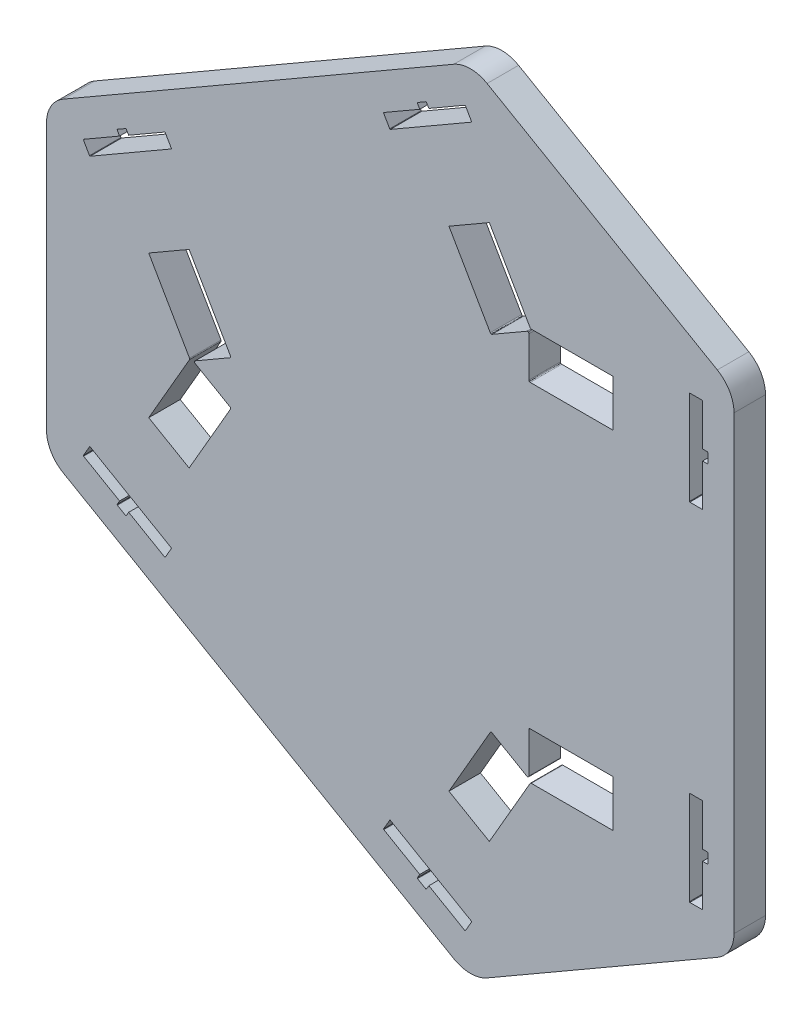
from build123d import *

# Parameters (mm, degrees)
SALIENTE_EXTRUIR1_DEPTH = 6


with BuildPart() as part:
    # Model → Saliente-Extruir1 (new body)
    with BuildSketch(Plane.XY):
        with BuildLine():
            Line((113.357081542, 26.21056425), (157.224997542, 51.53767625))
            add(Edge.make_bspline(
                [(157.224997542, 51.53767625), (159.190322542, 52.67288025), (160.400350542, 54.76749825), (160.399997542, 57.03698825)],
                knots=[0, 0, 0, 0, 1, 1, 1, 1], degree=3))
            Line((160.399997542, 57.03698825), (160.399997542, 142.96314225))
            add(Edge.make_bspline(
                [(160.399997542, 142.96314225), (160.399645542, 145.23256125), (159.190675542, 147.32841425), (157.224997542, 148.46259425)],
                knots=[0, 0, 0, 0, 1, 1, 1, 1], degree=3))
            Line((157.224997542, 148.46259425), (113.357081542, 173.78956925))
            add(Edge.make_bspline(
                [(113.357081542, 173.78956925), (111.391403542, 174.92375025), (108.972053542, 174.92480825), (107.007081542, 173.78956925)],
                knots=[0, 0, 0, 0, 1, 1, 1, 1], degree=3))
            Line((107.007081542, 173.78956925), (32.592792542, 130.82652825))
            add(Edge.make_bspline(
                [(32.592792542, 130.82652825), (30.627711542, 129.69128925), (29.417379542, 127.59649425), (29.417792542, 125.32707525)],
                knots=[0, 0, 0, 0, 1, 1, 1, 1], degree=3))
            Line((29.417792542, 125.32707525), (29.417792542, 74.67277225))
            add(Edge.make_bspline(
                [(29.417792542, 74.67277225), (29.418206542, 72.40335325), (30.627157542, 70.30785325), (32.592792542, 69.17367225)],
                knots=[0, 0, 0, 0, 1, 1, 1, 1], degree=3))
            Line((32.592792542, 69.17367225), (107.007081542, 26.21056425))
            add(Edge.make_bspline(
                [(107.007081542, 26.21056425), (108.972758542, 25.07630125), (111.391756542, 25.07533725), (113.357081542, 26.21056425)],
                knots=[0, 0, 0, 0, 1, 1, 1, 1], degree=3))
        make_face()
        with BuildLine():
            Line((52.048078542, 135.01541125), (53.198063542, 133.02362825))
            add(Edge.make_bspline(
                [(53.198063542, 133.02362825), (53.211292542, 133.00069725), (53.214855542, 132.97318125), (53.207976542, 132.94778125)],
                knots=[0, 0, 0, 0, 1, 1, 1, 1], degree=3))
            add(Edge.make_bspline(
                [(53.207976542, 132.94778125), (53.201202542, 132.92202825), (53.184269542, 132.90015625), (53.161374542, 132.88710325)],
                knots=[0, 0, 0, 0, 1, 1, 1, 1], degree=3))
            Line((53.161374542, 132.88710325), (37.746114542, 123.98687225))
            add(Edge.make_bspline(
                [(37.746114542, 123.98687225), (37.723218542, 123.97346725), (37.695949542, 123.96993925), (37.670302542, 123.97699425)],
                knots=[0, 0, 0, 0, 1, 1, 1, 1], degree=3))
            add(Edge.make_bspline(
                [(37.670302542, 123.97699425), (37.644690542, 123.98369725), (37.622783542, 124.00063125), (37.609553542, 124.02356125)],
                knots=[0, 0, 0, 0, 1, 1, 1, 1], degree=3))
            Line((37.609553542, 124.02356125), (36.459568542, 126.01534425))
            add(Edge.make_bspline(
                [(36.459568542, 126.01534425), (36.446339542, 126.03827525), (36.442741542, 126.06543925), (36.449514542, 126.09119225)],
                knots=[0, 0, 0, 0, 1, 1, 1, 1], degree=3))
            add(Edge.make_bspline(
                [(36.449514542, 126.09119225), (36.456393542, 126.11694425), (36.473221542, 126.13881725), (36.496081542, 126.15186925)],
                knots=[0, 0, 0, 0, 1, 1, 1, 1], degree=3))
            Line((36.496081542, 126.15186925), (43.337783542, 130.10192225))
            Line((43.337783542, 130.10192225), (42.887709542, 130.88156125))
            add(Edge.make_bspline(
                [(42.887709542, 130.88156125), (42.874480542, 130.90413925), (42.870881542, 130.93165625), (42.877796542, 130.95705625)],
                knots=[0, 0, 0, 0, 1, 1, 1, 1], degree=3))
            add(Edge.make_bspline(
                [(42.877796542, 130.95705625), (42.884675542, 130.98280825), (42.901467542, 131.00468125), (42.924362542, 131.01808625)],
                knots=[0, 0, 0, 0, 1, 1, 1, 1], degree=3))
            Line((42.924362542, 131.01808625), (44.483182542, 131.91802225))
            add(Edge.make_bspline(
                [(44.483182542, 131.91802225), (44.506077542, 131.93107525), (44.533347542, 131.93460325), (44.558993542, 131.92790025)],
                knots=[0, 0, 0, 0, 1, 1, 1, 1], degree=3))
            add(Edge.make_bspline(
                [(44.558993542, 131.92790025), (44.584605542, 131.92119725), (44.606513542, 131.90426425), (44.619742542, 131.88133325)],
                knots=[0, 0, 0, 0, 1, 1, 1, 1], degree=3))
            Line((44.619742542, 131.88133325), (45.069816542, 131.10204725))
            Line((45.069816542, 131.10204725), (51.911376542, 135.05174725))
            add(Edge.make_bspline(
                [(51.911376542, 135.05174725), (51.934377542, 135.06515325), (51.961682542, 135.06868125), (51.987153542, 135.06197825)],
                knots=[0, 0, 0, 0, 1, 1, 1, 1], degree=3))
            add(Edge.make_bspline(
                [(51.987153542, 135.06197825), (52.012800542, 135.05492225), (52.034707542, 135.03834225), (52.048078542, 135.01541125)],
                knots=[0, 0, 0, 0, 1, 1, 1, 1], degree=3))
        make_face(mode=Mode.SUBTRACT)
        with BuildLine():
            Line((36.459568542, 73.98485625), (37.609553542, 75.97663925))
            add(Edge.make_bspline(
                [(37.609553542, 75.97663925), (37.622783542, 75.99992225), (37.644690542, 76.01650325), (37.670161542, 76.02320625)],
                knots=[0, 0, 0, 0, 1, 1, 1, 1], degree=3))
            add(Edge.make_bspline(
                [(37.670161542, 76.02320625), (37.695808542, 76.03026125), (37.723218542, 76.02673325), (37.746114542, 76.01332825)],
                knots=[0, 0, 0, 0, 1, 1, 1, 1], degree=3))
            Line((37.746114542, 76.01332825), (53.161374542, 67.11345025))
            add(Edge.make_bspline(
                [(53.161374542, 67.11345025), (53.184410542, 67.10039725), (53.201061542, 67.07852525), (53.207976542, 67.05277225)],
                knots=[0, 0, 0, 0, 1, 1, 1, 1], degree=3))
            add(Edge.make_bspline(
                [(53.207976542, 67.05277225), (53.214855542, 67.02737225), (53.211292542, 66.99985625), (53.198063542, 66.97692525)],
                knots=[0, 0, 0, 0, 1, 1, 1, 1], degree=3))
            Line((53.198063542, 66.97692525), (52.048078542, 64.98514225))
            add(Edge.make_bspline(
                [(52.048078542, 64.98514225), (52.034848542, 64.96185825), (52.012941542, 64.94527825), (51.987294542, 64.93857525)],
                knots=[0, 0, 0, 0, 1, 1, 1, 1], degree=3))
            add(Edge.make_bspline(
                [(51.987294542, 64.93857525), (51.961823542, 64.93151925), (51.934377542, 64.93504725), (51.911376542, 64.94845325)],
                knots=[0, 0, 0, 0, 1, 1, 1, 1], degree=3))
            Line((51.911376542, 64.94845325), (45.069816542, 68.89850625))
            Line((45.069816542, 68.89850625), (44.619742542, 68.11921925))
            add(Edge.make_bspline(
                [(44.619742542, 68.11921925), (44.606654542, 68.09593625), (44.584746542, 68.07935625), (44.559135542, 68.07230025)],
                knots=[0, 0, 0, 0, 1, 1, 1, 1], degree=3))
            add(Edge.make_bspline(
                [(44.559135542, 68.07230025), (44.533488542, 68.06559725), (44.506218542, 68.06912525), (44.483182542, 68.08253125)],
                knots=[0, 0, 0, 0, 1, 1, 1, 1], degree=3))
            Line((44.483182542, 68.08253125), (42.924362542, 68.98246725))
            add(Edge.make_bspline(
                [(42.924362542, 68.98246725), (42.901467542, 68.99551925), (42.884675542, 69.01739225), (42.877796542, 69.04314425)],
                knots=[0, 0, 0, 0, 1, 1, 1, 1], degree=3))
            add(Edge.make_bspline(
                [(42.877796542, 69.04314425), (42.870881542, 69.06854425), (42.874480542, 69.09606125), (42.887709542, 69.11899225)],
                knots=[0, 0, 0, 0, 1, 1, 1, 1], degree=3))
            Line((42.887709542, 69.11899225), (43.337783542, 69.89827825))
            Line((43.337783542, 69.89827825), (36.496081542, 73.84833125))
            add(Edge.make_bspline(
                [(36.496081542, 73.84833125), (36.473221542, 73.86173625), (36.456393542, 73.88325625), (36.449514542, 73.90900825)],
                knots=[0, 0, 0, 0, 1, 1, 1, 1], degree=3))
            add(Edge.make_bspline(
                [(36.449514542, 73.90900825), (36.442741542, 73.93476125), (36.446339542, 73.96192525), (36.459568542, 73.98485625)],
                knots=[0, 0, 0, 0, 1, 1, 1, 1], degree=3))
        make_face(mode=Mode.SUBTRACT)
        with BuildLine():
            Line((110.390220542, 33.95678425), (109.240517542, 31.96496525))
            add(Edge.make_bspline(
                [(109.240517542, 31.96496525), (109.227111542, 31.94196425), (109.205239542, 31.92527825), (109.179839542, 31.91839925)],
                knots=[0, 0, 0, 0, 1, 1, 1, 1], degree=3))
            add(Edge.make_bspline(
                [(109.179839542, 31.91839925), (109.154086542, 31.91151925), (109.126570542, 31.91508225), (109.103639542, 31.92845325)],
                knots=[0, 0, 0, 0, 1, 1, 1, 1], degree=3))
            Line((109.103639542, 31.92845325), (102.262220542, 35.87847025))
            Line((102.262220542, 35.87847025), (101.812075542, 35.09904325))
            add(Edge.make_bspline(
                [(101.812075542, 35.09904325), (101.799022542, 35.07604225), (101.777150542, 35.05921425), (101.751397542, 35.05247625)],
                knots=[0, 0, 0, 0, 1, 1, 1, 1], degree=3))
            add(Edge.make_bspline(
                [(101.751397542, 35.05247625), (101.725997542, 35.04545625), (101.698481542, 35.04916025), (101.675550542, 35.06238925)],
                knots=[0, 0, 0, 0, 1, 1, 1, 1], degree=3))
            Line((101.675550542, 35.06238925), (100.116625542, 35.96239625))
            add(Edge.make_bspline(
                [(100.116625542, 35.96239625), (100.093695542, 35.97562525), (100.077114542, 35.99739225), (100.070058542, 36.02303925)],
                knots=[0, 0, 0, 0, 1, 1, 1, 1], degree=3))
            add(Edge.make_bspline(
                [(100.070058542, 36.02303925), (100.063356542, 36.04865025), (100.066883542, 36.07595525), (100.080289542, 36.09895625)],
                knots=[0, 0, 0, 0, 1, 1, 1, 1], degree=3))
            Line((100.080289542, 36.09895625), (100.530081542, 36.87838425))
            Line((100.530081542, 36.87838425), (93.688661542, 40.82836625))
            add(Edge.make_bspline(
                [(93.688661542, 40.82836625), (93.665378542, 40.84159525), (93.648797542, 40.86339725), (93.642095542, 40.88900825)],
                knots=[0, 0, 0, 0, 1, 1, 1, 1], degree=3))
            add(Edge.make_bspline(
                [(93.642095542, 40.88900825), (93.635039542, 40.91465525), (93.638567542, 40.94206625), (93.651972542, 40.96496125)],
                knots=[0, 0, 0, 0, 1, 1, 1, 1], degree=3))
            Line((93.651972542, 40.96496125), (94.802028542, 42.95674525))
            add(Edge.make_bspline(
                [(94.802028542, 42.95674525), (94.815081542, 42.97978125), (94.836953542, 42.99657325), (94.862353542, 43.00334725)],
                knots=[0, 0, 0, 0, 1, 1, 1, 1], degree=3))
            add(Edge.make_bspline(
                [(94.862353542, 43.00334725), (94.888106542, 43.01036725), (94.915622542, 43.00666325), (94.938553542, 42.99343425)],
                knots=[0, 0, 0, 0, 1, 1, 1, 1], degree=3))
            Line((94.938553542, 42.99343425), (110.353531542, 34.09334425))
            add(Edge.make_bspline(
                [(110.353531542, 34.09334425), (110.376814542, 34.08025625), (110.393395542, 34.05834925), (110.400450542, 34.03287825)],
                knots=[0, 0, 0, 0, 1, 1, 1, 1], degree=3))
            add(Edge.make_bspline(
                [(110.400450542, 34.03287825), (110.407153542, 34.00723125), (110.403625542, 33.97982025), (110.390220542, 33.95678425)],
                knots=[0, 0, 0, 0, 1, 1, 1, 1], degree=3))
        make_face(mode=Mode.SUBTRACT)
        with BuildLine():
            Line((155.400078542, 133.92038925), (155.400078542, 132.12016425))
            add(Edge.make_bspline(
                [(155.400078542, 132.12016425), (155.400078542, 132.09370625), (155.389495542, 132.06830625), (155.370797542, 132.04960825)],
                knots=[0, 0, 0, 0, 1, 1, 1, 1], degree=3))
            add(Edge.make_bspline(
                [(155.370797542, 132.04960825), (155.352100542, 132.03055825), (155.326347542, 132.02032825), (155.299889542, 132.02032825)],
                knots=[0, 0, 0, 0, 1, 1, 1, 1], degree=3))
            Line((155.299889542, 132.02032825), (154.399953542, 132.02032825))
            Line((154.399953542, 132.02032825), (154.399953542, 124.12022225))
            add(Edge.make_bspline(
                [(154.399953542, 124.12022225), (154.399953542, 124.09376425), (154.389370542, 124.06836425), (154.370672542, 124.04931425)],
                knots=[0, 0, 0, 0, 1, 1, 1, 1], degree=3))
            add(Edge.make_bspline(
                [(154.370672542, 124.04931425), (154.351975542, 124.03061725), (154.326575542, 124.02038625), (154.299764542, 124.02038625)],
                knots=[0, 0, 0, 0, 1, 1, 1, 1], degree=3))
            Line((154.299764542, 124.02038625), (152.000006542, 124.02038625))
            add(Edge.make_bspline(
                [(152.000006542, 124.02038625), (151.973547542, 124.02003325), (151.948147542, 124.03061725), (151.929097542, 124.04931425)],
                knots=[0, 0, 0, 0, 1, 1, 1, 1], degree=3))
            add(Edge.make_bspline(
                [(151.929097542, 124.04931425), (151.910400542, 124.06801125), (151.899817542, 124.09376425), (151.899817542, 124.12022225)],
                knots=[0, 0, 0, 0, 1, 1, 1, 1], degree=3))
            Line((151.899817542, 124.12022225), (151.899817542, 141.92033125))
            add(Edge.make_bspline(
                [(151.899817542, 141.92033125), (151.899817542, 141.94678925), (151.910400542, 141.97218925), (151.929097542, 141.99088625)],
                knots=[0, 0, 0, 0, 1, 1, 1, 1], degree=3))
            add(Edge.make_bspline(
                [(151.929097542, 141.99088625), (151.948147542, 142.00958325), (151.973547542, 142.02016725), (152.000006542, 142.02016725)],
                knots=[0, 0, 0, 0, 1, 1, 1, 1], degree=3))
            Line((152.000006542, 142.02016725), (154.299764542, 142.02016725))
            add(Edge.make_bspline(
                [(154.299764542, 142.02016725), (154.326575542, 142.02016725), (154.351975542, 142.00958325), (154.370672542, 141.99088625)],
                knots=[0, 0, 0, 0, 1, 1, 1, 1], degree=3))
            add(Edge.make_bspline(
                [(154.370672542, 141.99088625), (154.389370542, 141.97218925), (154.399953542, 141.94678925), (154.399953542, 141.92033125)],
                knots=[0, 0, 0, 0, 1, 1, 1, 1], degree=3))
            Line((154.399953542, 141.92033125), (154.399953542, 134.02022525))
            Line((154.399953542, 134.02022525), (155.299889542, 134.02022525))
            add(Edge.make_bspline(
                [(155.299889542, 134.02022525), (155.326347542, 134.02022525), (155.351747542, 134.00964225), (155.370797542, 133.99094425)],
                knots=[0, 0, 0, 0, 1, 1, 1, 1], degree=3))
            add(Edge.make_bspline(
                [(155.370797542, 133.99094425), (155.389495542, 133.97224725), (155.400078542, 133.94684725), (155.400078542, 133.92038925)],
                knots=[0, 0, 0, 0, 1, 1, 1, 1], degree=3))
        make_face(mode=Mode.SUBTRACT)
        with BuildLine():
            Line((121.31992491, 128.831895052), (121.320083692, 136.487462979))
            add(Edge.make_bspline(
                [(121.320083692, 136.487462979), (121.319954506, 136.578255399), (121.271119345, 136.662298528), (121.192460467, 136.707385355)],
                knots=[0, 0, 0, 0, 1, 1, 1, 1], degree=3))
            add(Edge.make_bspline(
                [(121.192460467, 136.707385355), (121.113567748, 136.752771157), (121.017547937, 136.752971857), (120.939106745, 136.707419551)],
                knots=[0, 0, 0, 0, 1, 1, 1, 1], degree=3))
            Line((120.939106745, 136.707419551), (114.308973597, 132.879659169))
            add(Edge.make_bspline(
                [(114.308973597, 132.879659169), (114.25079266, 132.845914699), (114.181536987, 132.836732259), (114.116267685, 132.854210473)],
                knots=[0, 0, 0, 0, 1, 1, 1, 1], degree=3))
            add(Edge.make_bspline(
                [(114.116267685, 132.854210473), (114.051304091, 132.871512188), (113.995739376, 132.914265298), (113.962209337, 132.972607644)],
                knots=[0, 0, 0, 0, 1, 1, 1, 1], degree=3))
            Line((113.962209337, 132.972607644), (106.088920823, 146.609023042))
            Line((106.088920823, 146.609023042), (113.787789899, 151.053794417))
            Line((113.787789899, 151.053794417), (121.55860695, 137.594865806))
            add(Edge.make_bspline(
                [(121.55860695, 137.594865806), (121.604070391, 137.516272694), (121.688087034, 137.467765788), (121.778577546, 137.467866053)],
                knots=[0, 0, 0, 0, 1, 1, 1, 1], degree=3))
            Line((121.778577546, 137.467866053), (137.320104025, 137.467640325))
            Line((137.320104025, 137.467640325), (137.319919654, 128.57832527))
            Line((137.319919654, 128.57832527), (121.574109058, 128.577886702))
            add(Edge.make_bspline(
                [(121.574109058, 128.577886702), (121.506818085, 128.577753243), (121.442010388, 128.604496997), (121.394544759, 128.652106156)],
                knots=[0, 0, 0, 0, 1, 1, 1, 1], degree=3))
            add(Edge.make_bspline(
                [(121.394544759, 128.652106156), (121.346702923, 128.699769705), (121.320168168, 128.764582256), (121.31992491, 128.831895052)],
                knots=[0, 0, 0, 0, 1, 1, 1, 1], degree=3))
        make_face(mode=Mode.SUBTRACT)
        with BuildLine():
            Line((114.308949948, 67.120442979), (120.938783406, 63.292515521))
            add(Edge.make_bspline(
                [(120.938783406, 63.292515521), (121.0174765, 63.247231119), (121.114677566, 63.247501956), (121.193053383, 63.293079058)],
                knots=[0, 0, 0, 0, 1, 1, 1, 1], degree=3))
            add(Edge.make_bspline(
                [(121.193053383, 63.293079058), (121.271805041, 63.338709185), (121.319988834, 63.421764387), (121.319760057, 63.512472605)],
                knots=[0, 0, 0, 0, 1, 1, 1, 1], degree=3))
            Line((121.319760057, 63.512472605), (121.319895812, 71.168216533))
            add(Edge.make_bspline(
                [(121.319895812, 71.168216533), (121.319762772, 71.235474938), (121.346438441, 71.300043306), (121.394209713, 71.347829029)],
                knots=[0, 0, 0, 0, 1, 1, 1, 1], degree=3))
            add(Edge.make_bspline(
                [(121.394209713, 71.347829029), (121.441675277, 71.395438252), (121.506482939, 71.422182093), (121.573773911, 71.422048725)],
                knots=[0, 0, 0, 0, 1, 1, 1, 1], degree=3))
            Line((121.573773911, 71.422048725), (137.31990032, 71.422294676))
            Line((137.31990032, 71.422294676), (137.319742682, 62.532492789))
            Line((137.319742682, 62.532492789), (121.778560071, 62.532246148))
            add(Edge.make_bspline(
                [(121.778560071, 62.532246148), (121.687764719, 62.532170292), (121.603748141, 62.483663273), (121.558589647, 62.405246099)],
                knots=[0, 0, 0, 0, 1, 1, 1, 1], degree=3))
            Line((121.558589647, 62.405246099), (113.787618771, 48.946009234))
            Line((113.787618771, 48.946009234), (106.089342309, 53.390833381))
            Line((106.089342309, 53.390833381), (113.961880106, 67.027317538))
            add(Edge.make_bspline(
                [(113.961880106, 67.027317538), (113.995410065, 67.085659929), (114.050974723, 67.128413114), (114.115938295, 67.145714916)],
                knots=[0, 0, 0, 0, 1, 1, 1, 1], degree=3))
            add(Edge.make_bspline(
                [(114.115938295, 67.145714916), (114.181137073, 67.163315327), (114.250533758, 67.153888762), (114.308949948, 67.120442979)],
                knots=[0, 0, 0, 0, 1, 1, 1, 1], degree=3))
        make_face(mode=Mode.SUBTRACT)
        with BuildLine():
            Line((64.37094141, 104.04778068), (57.74094141, 100.22014168))
            add(Edge.make_bspline(
                [(57.74094141, 100.22014168), (57.66237741, 100.17463368), (57.61401141, 100.09031968), (57.61429441, 99.99965568)],
                knots=[0, 0, 0, 0, 1, 1, 1, 1], degree=3))
            add(Edge.make_bspline(
                [(57.61429441, 99.99965568), (57.61443541, 99.90863968), (57.66227141, 99.82538368), (57.74094141, 99.78022768)],
                knots=[0, 0, 0, 0, 1, 1, 1, 1], degree=3))
            Line((57.74094141, 99.78022768), (64.37094141, 95.95223668))
            add(Edge.make_bspline(
                [(64.37094141, 95.95223668), (64.42925541, 95.91872268), (64.47183541, 95.86333668), (64.48933341, 95.79807268)],
                knots=[0, 0, 0, 0, 1, 1, 1, 1], degree=3))
            add(Edge.make_bspline(
                [(64.48933341, 95.79807268), (64.50683141, 95.73316168), (64.49758841, 95.66366468), (64.46382741, 95.60545568)],
                knots=[0, 0, 0, 0, 1, 1, 1, 1], degree=3))
            Line((64.46382741, 95.60545568), (56.590974184, 81.968788968))
            Line((56.590974184, 81.968788968), (48.892259719, 86.413828136))
            Line((48.892259719, 86.413828136), (56.66264041, 99.87300868))
            add(Edge.make_bspline(
                [(56.66264041, 99.87300868), (56.70797241, 99.95167768), (56.70797241, 100.04869168), (56.66264041, 100.12700868)],
                knots=[0, 0, 0, 0, 1, 1, 1, 1], degree=3))
            Line((56.66264041, 100.12700868), (48.89208779, 113.586487026))
            Line((48.89208779, 113.586487026), (56.590557632, 118.030976227))
            Line((56.590557632, 118.030976227), (64.46382741, 104.39491468))
            add(Edge.make_bspline(
                [(64.46382741, 104.39491468), (64.49758841, 104.33670568), (64.50683141, 104.26720868), (64.48933341, 104.20229768)],
                knots=[0, 0, 0, 0, 1, 1, 1, 1], degree=3))
            add(Edge.make_bspline(
                [(64.48933341, 104.20229768), (64.47197641, 104.13703368), (64.42911441, 104.08164768), (64.37094141, 104.04778068)],
                knots=[0, 0, 0, 0, 1, 1, 1, 1], degree=3))
        make_face(mode=Mode.SUBTRACT)
        with BuildLine():
            Line((155.400078542, 67.88038925), (155.400078542, 66.08016425))
            add(Edge.make_bspline(
                [(155.400078542, 66.08016425), (155.400078542, 66.05370625), (155.389495542, 66.02830625), (155.370797542, 66.00960825)],
                knots=[0, 0, 0, 0, 1, 1, 1, 1], degree=3))
            add(Edge.make_bspline(
                [(155.370797542, 66.00960825), (155.352100542, 65.99055825), (155.326347542, 65.98032825), (155.299889542, 65.98032825)],
                knots=[0, 0, 0, 0, 1, 1, 1, 1], degree=3))
            Line((155.299889542, 65.98032825), (154.399953542, 65.98032825))
            Line((154.399953542, 65.98032825), (154.399953542, 58.08022225))
            add(Edge.make_bspline(
                [(154.399953542, 58.08022225), (154.399953542, 58.05376425), (154.389370542, 58.02836425), (154.370672542, 58.00931425)],
                knots=[0, 0, 0, 0, 1, 1, 1, 1], degree=3))
            add(Edge.make_bspline(
                [(154.370672542, 58.00931425), (154.351975542, 57.99061725), (154.326575542, 57.98038625), (154.299764542, 57.98038625)],
                knots=[0, 0, 0, 0, 1, 1, 1, 1], degree=3))
            Line((154.299764542, 57.98038625), (152.000006542, 57.98038625))
            add(Edge.make_bspline(
                [(152.000006542, 57.98038625), (151.973547542, 57.98003325), (151.948147542, 57.99061725), (151.929097542, 58.00931425)],
                knots=[0, 0, 0, 0, 1, 1, 1, 1], degree=3))
            add(Edge.make_bspline(
                [(151.929097542, 58.00931425), (151.910400542, 58.02801125), (151.899817542, 58.05376425), (151.899817542, 58.08022225)],
                knots=[0, 0, 0, 0, 1, 1, 1, 1], degree=3))
            Line((151.899817542, 58.08022225), (151.899817542, 75.88033125))
            add(Edge.make_bspline(
                [(151.899817542, 75.88033125), (151.899817542, 75.90678925), (151.910400542, 75.93218925), (151.929097542, 75.95088625)],
                knots=[0, 0, 0, 0, 1, 1, 1, 1], degree=3))
            add(Edge.make_bspline(
                [(151.929097542, 75.95088625), (151.948147542, 75.96958325), (151.973547542, 75.98016725), (152.000006542, 75.98016725)],
                knots=[0, 0, 0, 0, 1, 1, 1, 1], degree=3))
            Line((152.000006542, 75.98016725), (154.299764542, 75.98016725))
            add(Edge.make_bspline(
                [(154.299764542, 75.98016725), (154.326575542, 75.98016725), (154.351975542, 75.96958325), (154.370672542, 75.95088625)],
                knots=[0, 0, 0, 0, 1, 1, 1, 1], degree=3))
            add(Edge.make_bspline(
                [(154.370672542, 75.95088625), (154.389370542, 75.93218925), (154.399953542, 75.90678925), (154.399953542, 75.88033125)],
                knots=[0, 0, 0, 0, 1, 1, 1, 1], degree=3))
            Line((154.399953542, 75.88033125), (154.399953542, 67.98022525))
            Line((154.399953542, 67.98022525), (155.299889542, 67.98022525))
            add(Edge.make_bspline(
                [(155.299889542, 67.98022525), (155.326347542, 67.98022525), (155.351747542, 67.96964225), (155.370797542, 67.95094425)],
                knots=[0, 0, 0, 0, 1, 1, 1, 1], degree=3))
            add(Edge.make_bspline(
                [(155.370797542, 67.95094425), (155.389495542, 67.93224725), (155.400078542, 67.90684725), (155.400078542, 67.88038925)],
                knots=[0, 0, 0, 0, 1, 1, 1, 1], degree=3))
        make_face(mode=Mode.SUBTRACT)
        with BuildLine():
            Line((94.801869042, 157.04356125), (93.651884042, 159.03534425))
            add(Edge.make_bspline(
                [(93.651884042, 159.03534425), (93.638655042, 159.05827525), (93.635057042, 159.08543925), (93.641830042, 159.11119225)],
                knots=[0, 0, 0, 0, 1, 1, 1, 1], degree=3))
            add(Edge.make_bspline(
                [(93.641830042, 159.11119225), (93.648709042, 159.13694425), (93.665537042, 159.15881725), (93.688397042, 159.17186925)],
                knots=[0, 0, 0, 0, 1, 1, 1, 1], degree=3))
            Line((93.688397042, 159.17186925), (100.530099042, 163.12192225))
            Line((100.530099042, 163.12192225), (100.080025042, 163.90156125))
            add(Edge.make_bspline(
                [(100.080025042, 163.90156125), (100.066796042, 163.92413925), (100.063197042, 163.95165625), (100.070112042, 163.97705625)],
                knots=[0, 0, 0, 0, 1, 1, 1, 1], degree=3))
            add(Edge.make_bspline(
                [(100.070112042, 163.97705625), (100.076991042, 164.00280825), (100.093783042, 164.02468125), (100.116678042, 164.03808625)],
                knots=[0, 0, 0, 0, 1, 1, 1, 1], degree=3))
            Line((100.116678042, 164.03808625), (101.675498042, 164.93802225))
            add(Edge.make_bspline(
                [(101.675498042, 164.93802225), (101.698393042, 164.95107525), (101.725663042, 164.95460325), (101.751309042, 164.94790025)],
                knots=[0, 0, 0, 0, 1, 1, 1, 1], degree=3))
            add(Edge.make_bspline(
                [(101.751309042, 164.94790025), (101.776921042, 164.94119725), (101.798829042, 164.92426425), (101.812058042, 164.90133325)],
                knots=[0, 0, 0, 0, 1, 1, 1, 1], degree=3))
            Line((101.812058042, 164.90133325), (102.262132042, 164.12204725))
            Line((102.262132042, 164.12204725), (109.103692042, 168.07174725))
            add(Edge.make_bspline(
                [(109.103692042, 168.07174725), (109.126693042, 168.08515325), (109.153998042, 168.08868125), (109.179469042, 168.08197825)],
                knots=[0, 0, 0, 0, 1, 1, 1, 1], degree=3))
            add(Edge.make_bspline(
                [(109.179469042, 168.08197825), (109.205116042, 168.07492225), (109.227023042, 168.05834225), (109.240394042, 168.03541125)],
                knots=[0, 0, 0, 0, 1, 1, 1, 1], degree=3))
            Line((109.240394042, 168.03541125), (110.390379042, 166.04362825))
            add(Edge.make_bspline(
                [(110.390379042, 166.04362825), (110.403608042, 166.02069725), (110.407171042, 165.99318125), (110.400292042, 165.96778125)],
                knots=[0, 0, 0, 0, 1, 1, 1, 1], degree=3))
            add(Edge.make_bspline(
                [(110.400292042, 165.96778125), (110.393518042, 165.94202825), (110.376585042, 165.92015625), (110.353690042, 165.90710325)],
                knots=[0, 0, 0, 0, 1, 1, 1, 1], degree=3))
            Line((110.353690042, 165.90710325), (94.938430042, 157.00687225))
            add(Edge.make_bspline(
                [(94.938430042, 157.00687225), (94.915534042, 156.99346725), (94.888265042, 156.98993925), (94.862618042, 156.99699425)],
                knots=[0, 0, 0, 0, 1, 1, 1, 1], degree=3))
            add(Edge.make_bspline(
                [(94.862618042, 156.99699425), (94.837006042, 157.00369725), (94.815099042, 157.02063125), (94.801869042, 157.04356125)],
                knots=[0, 0, 0, 0, 1, 1, 1, 1], degree=3))
        make_face(mode=Mode.SUBTRACT)
    extrude(amount=SALIENTE_EXTRUIR1_DEPTH)


solid = part.part
